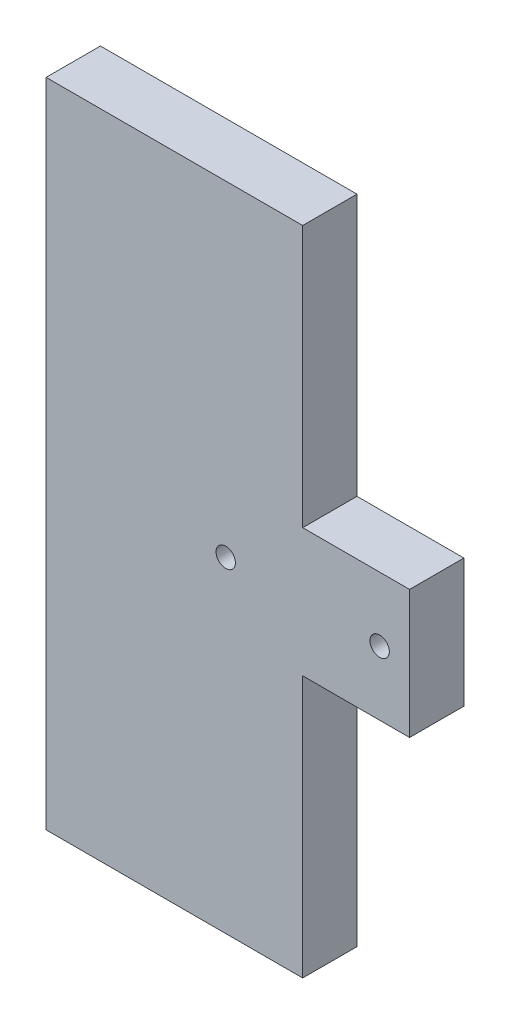
from build123d import *

# Parameters (mm, degrees)
SKETCH1_R           = 1.1303
BOSS_EXTRUDE1_DEPTH = 6.35


with BuildPart() as part:
    # Sketch1 → Boss-Extrude1 (new body)
    with BuildSketch(Plane.XY):
        Polygon((0, -7.5), (0, -38.1), (-30, -38.1), (-30, 38.1), (0, 38.1), (0, 7.5), (12.5, 7.5), (12.5, -7.5), align=None)
        with Locations((-9, 0)):
            Circle(SKETCH1_R, mode=Mode.SUBTRACT)
        with Locations((9, 0)):
            Circle(SKETCH1_R, mode=Mode.SUBTRACT)
    extrude(amount=BOSS_EXTRUDE1_DEPTH)


solid = part.part
